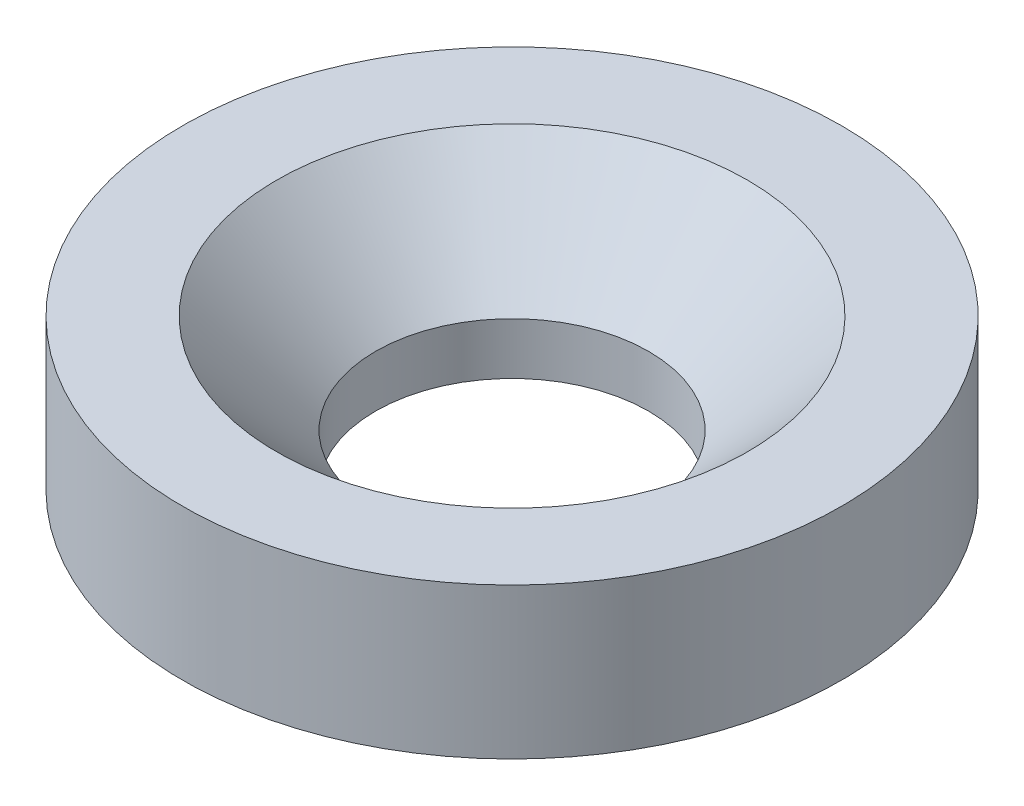
from build123d import *


with BuildPart() as part:
    # Sketch1 → Revolve1 (revolve)
    with BuildSketch(Plane.XY, mode=Mode.PRIVATE) as revolve1_sk:
        Polygon((7.25, 0), (17.5, 0), (17.5, 8), (12.5, 8), (7.25, 2.75), align=None)
    revolve(revolve1_sk.sketch.rotate(Axis((0, 0, 0), (0, 1, 0)), 90), axis=Axis((0, 0, 0), (0, 1, 0)))


solid = part.part
